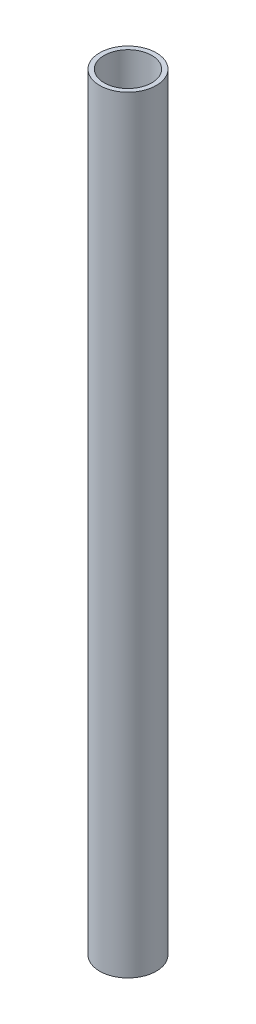
from build123d import *

# Parameters (mm, degrees)
SKETCH1_R           = 0.535
SKETCH1_R_2         = 0.45
BOSS_EXTRUDE1_DEPTH = 14.5


with BuildPart() as part:
    # Sketch1 → Boss-Extrude1 (new body)
    with BuildSketch(Plane(origin=(0, 0, 0), x_dir=(1, 0, 0), z_dir=(0, 1, 0))):
        with Locations(Location((0, 0, 0), (0, 0, 270))):
            Circle(SKETCH1_R)
        with Locations(Location((0, 0, 0), (0, 0, 270))):
            Circle(SKETCH1_R_2, mode=Mode.SUBTRACT)
    extrude(amount=BOSS_EXTRUDE1_DEPTH)


solid = part.part
